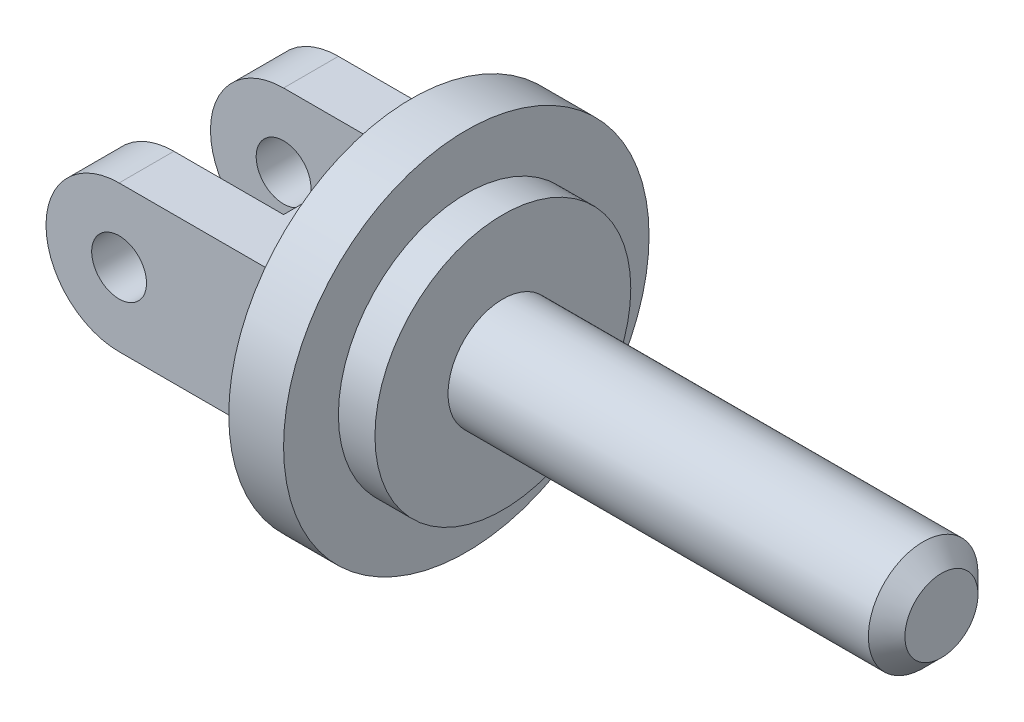
from build123d import *

# Parameters (mm, degrees)
EXTRUDE_1_DEPTH     = 3
SKETCH_2_R          = 5
EXTRUDE_2_DEPTH     = 1.5
SKETCH_3_R          = 3.5
EXTRUDE_3_DEPTH     = 1
SKETCH_4_R          = 1.5
EXTRUDE_4_DEPTH     = 12
SKETCH_5_W          = 10
SKETCH_5_H          = 3
CUT_EXTRUDE_1_DEPTH = 22.313141486
CHAMFER_1_SIZE      = 0.5


with BuildPart() as part:
    # 草图1 → 凸台-拉伸1 (new, symmetric)
    with BuildSketch(Plane.XY):
        with BuildLine():
            Line((5, 2), (0, 2))
            ThreePointArc((0, 2), (1.414213562, 1.414213562), (2, 0))
            ThreePointArc((2, 0), (1.414213562, -1.414213562), (0, -2))
            Line((0, -2), (5, -2))
            Line((5, -2), (5, 2))
        make_face()
        with BuildLine():
            ThreePointArc((2, 0), (1.414213562, 1.414213562), (0, 2))
            Line((0, 2), (0, 0.75))
            ThreePointArc((0, 0.75), (0.530330086, 0.530330086), (0.75, 0))
            ThreePointArc((0.75, 0), (0.530330086, -0.530330086), (0, -0.75))
            Line((0, -0.75), (0, -2))
            ThreePointArc((0, -2), (1.414213562, -1.414213562), (2, 0))
        make_face()
        with BuildLine():
            Line((0, 0.75), (0, 2))
            ThreePointArc((0, 2), (-2, 0), (0, -2))
            Line((0, -2), (0, -0.75))
            ThreePointArc((0, -0.75), (-0.75, 0), (0, 0.75))
        make_face()
    extrude(amount=EXTRUDE_1_DEPTH, both=True)

    # 草图2 → 凸台-拉伸2 (add)
    with BuildSketch(Plane(origin=(5, 0, 0), x_dir=(0, 0, -1), z_dir=(1, 0, 0))):
        Circle(SKETCH_2_R)
    extrude(amount=EXTRUDE_2_DEPTH)

    # 草图3 → 凸台-拉伸3 (add)
    with BuildSketch(Plane(origin=(6.5, 0, 0), x_dir=(0, 0, -1), z_dir=(1, 0, 0))):
        Circle(SKETCH_3_R)
    extrude(amount=EXTRUDE_3_DEPTH)

    # 草图4 → 凸台-拉伸4 (add)
    with BuildSketch(Plane(origin=(7.5, 0, 0), x_dir=(0, 0, -1), z_dir=(1, 0, 0))):
        Circle(SKETCH_4_R)
    extrude(amount=EXTRUDE_4_DEPTH)

    # 草图5 → 切除-拉伸1 (cut, through all)
    with BuildSketch(Plane(origin=(0, 2, 0), x_dir=(1, 0, 0), z_dir=(0, 1, 0))):
        with Locations((-2, 0)):
            Rectangle(SKETCH_5_W, SKETCH_5_H)
    extrude(amount=-CUT_EXTRUDE_1_DEPTH, mode=Mode.SUBTRACT)

    # 倒角1
    chamfer_1_edges = [part.edges().sort_by_distance(p)[0] for p in [
        (19.5, 0, 1.5),
    ]]
    chamfer(chamfer_1_edges, length=CHAMFER_1_SIZE)


solid = part.part
